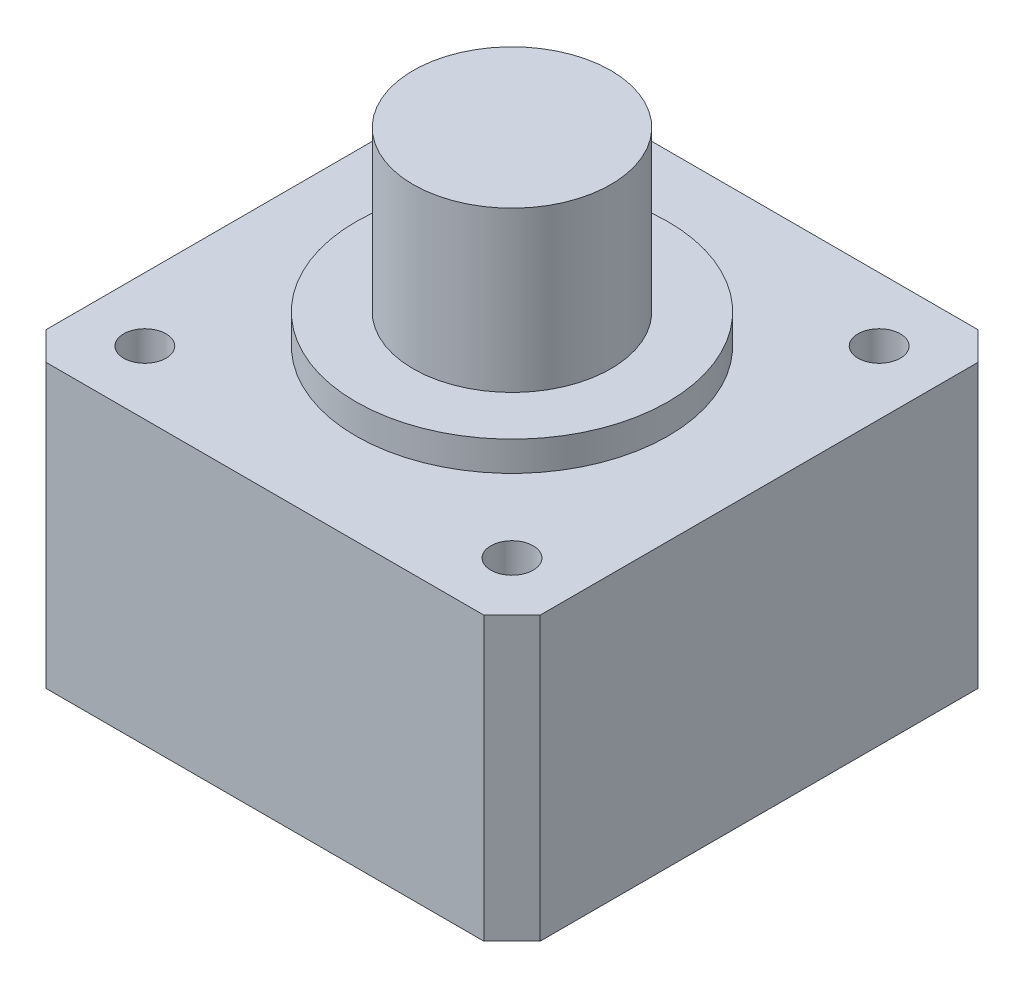
from build123d import *

# Parameters (mm, degrees)
SKETCH1_W           = 35
SKETCH1_H           = 35
BOSS_EXTRUDE1_DEPTH = 20
SKETCH3_R           = 1.5
CUT_EXTRUDE1_DEPTH  = 20
CHAMFER1_SIZE       = 2
SKETCH4_R           = 11.05
BOSS_EXTRUDE2_DEPTH = 2.1
SKETCH5_R           = 7
BOSS_EXTRUDE3_DEPTH = 11.3


with BuildPart() as part:
    # Sketch1 → Boss-Extrude1 (new body)
    with BuildSketch(Plane(origin=(0, 0, 0), x_dir=(1, 0, 0), z_dir=(0, 1, 0))):
        Rectangle(SKETCH1_W, SKETCH1_H)
    extrude(amount=BOSS_EXTRUDE1_DEPTH)

    # Sketch3 → Cut-Extrude1 (cut)
    with BuildSketch(Plane(origin=(0, 20, 0), x_dir=(1, 0, 0), z_dir=(0, 1, 0))):
        with Locations(Location((13, 13, 0), (0, 0, 270))):
            Circle(SKETCH3_R)
        with Locations(Location((13, -13, 0), (0, 0, 270))):
            Circle(SKETCH3_R)
        with Locations(Location((-13, -13, 0), (0, 0, 270))):
            Circle(SKETCH3_R)
        with Locations(Location((-13, 13, 0), (0, 0, 270))):
            Circle(SKETCH3_R)
    extrude(amount=-CUT_EXTRUDE1_DEPTH, mode=Mode.SUBTRACT)

    # Chamfer1
    chamfer1_edges = [part.edges().sort_by_distance(p)[0] for p in [
        (17.5, 10, 17.5),
        (-17.5, 10, 17.5),
        (-17.5, 10, -17.5),
        (17.5, 10, -17.5),
    ]]
    chamfer(chamfer1_edges, length=CHAMFER1_SIZE)

    # Sketch4 → Boss-Extrude2 (add)
    with BuildSketch(Plane(origin=(0, 20, 0), x_dir=(1, 0, 0), z_dir=(0, 1, 0))):
        with Locations(Location((0, 0, 0), (0, 0, 270))):
            Circle(SKETCH4_R)
    extrude(amount=BOSS_EXTRUDE2_DEPTH)

    # Sketch5 → Boss-Extrude3 (add)
    with BuildSketch(Plane(origin=(0, 22.1, 0), x_dir=(1, 0, 0), z_dir=(0, 1, 0))):
        with Locations(Location((0, 0, 0), (0, 0, 270))):
            Circle(SKETCH5_R)
    extrude(amount=BOSS_EXTRUDE3_DEPTH)


solid = part.part
